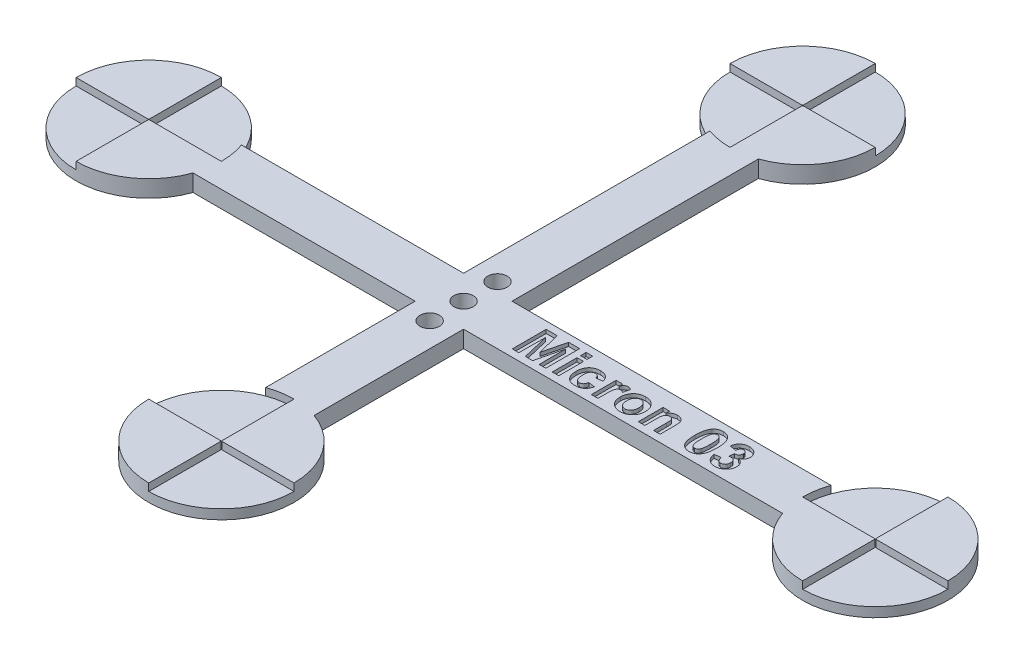
from build123d import *

# Parameters (mm, degrees)
BOSS_EXTRUDE1_DEPTH = 3.5
CUT_EXTRUDE1_START  = -1.52
CUT_EXTRUDE1_DEPTH  = 1.52
SKETCH3_R           = 2
CUT_EXTRUDE2_DEPTH  = 186.640108813
SKETCH5_W           = 1.346153846
SKETCH5_H           = 1.166666667
SKETCH5_H_2         = 5.115384615
CUT_EXTRUDE3_DEPTH  = 0.75


with BuildPart() as part:
    # Sketch1 → Boss-Extrude1 (new body)
    with BuildSketch(Plane(origin=(0, 0, 0), x_dir=(1, 0, 0), z_dir=(0, 1, 0))):
        with BuildLine():
            Line((60, 55.857864376), (60, 5))
            Line((60, 5), (14.142135624, 5))
            ThreePointArc((14.142135624, 5), (-15, 0), (14.142135624, -5))
            Line((14.142135624, -5), (60, -5))
            Line((60, -5), (60, -35.857864376))
            ThreePointArc((60, -35.857864376), (65, -65), (70, -35.857864376))
            Line((70, -35.857864376), (70, -5))
            Line((70, -5), (135.857864376, -5))
            ThreePointArc((135.857864376, -5), (165, 0), (135.857864376, 5))
            Line((135.857864376, 5), (70, 5))
            Line((70, 5), (70, 55.857864376))
            ThreePointArc((70, 55.857864376), (65, 85), (60, 55.857864376))
        make_face()
    extrude(amount=BOSS_EXTRUDE1_DEPTH)

    # Sketch2 → Cut-Extrude1 (cut)
    with BuildSketch(Plane(origin=(0, 3.5, 0), x_dir=(1, 0, 0), z_dir=(0, 1, 0)).offset(CUT_EXTRUDE1_START)):
        with BuildLine():
            Line((65, -65), (65, -50.1))
            ThreePointArc((65, -50.1), (64.929289322, -50.070710678), (64.9, -50))
            Line((64.9, -50), (50, -50))
            ThreePointArc((50, -50), (54.393398282, -39.393398282), (65, -35))
            Line((65, -35), (65, -49.9))
            ThreePointArc((65, -49.9), (65.070710678, -49.929289322), (65.1, -50))
            Line((65.1, -50), (80, -50))
            ThreePointArc((80, -50), (75.606601718, -60.606601718), (65, -65))
        make_face()
        with BuildLine():
            Line((-15, 0), (-0.1, 0))
            ThreePointArc((-0.1, 0), (-0.070710678, 0.070710678), (0, 0.1))
            Line((0, 0.1), (0, 15))
            ThreePointArc((0, 15), (10.606601718, 10.606601718), (15, 0))
            Line((15, 0), (0.1, 0))
            ThreePointArc((0.1, 0), (0.070710678, -0.070710678), (0, -0.1))
            Line((0, -0.1), (0, -15))
            ThreePointArc((0, -15), (-10.606601718, -10.606601718), (-15, 0))
        make_face()
        with BuildLine():
            Line((50, 70), (64.9, 70))
            ThreePointArc((64.9, 70), (64.929289322, 70.070710678), (65, 70.1))
            Line((65, 70.1), (65, 85))
            ThreePointArc((65, 85), (75.606601718, 80.606601718), (80, 70))
            Line((80, 70), (65.1, 70))
            ThreePointArc((65.1, 70), (65.070710678, 69.929289322), (65, 69.9))
            Line((65, 69.9), (65, 55))
            ThreePointArc((65, 55), (54.393398282, 59.393398282), (50, 70))
        make_face()
        with BuildLine():
            Line((150, 15), (150, 0.1))
            ThreePointArc((150, 0.1), (150.070710678, 0.070710678), (150.1, 0))
            Line((150.1, 0), (165, 0))
            ThreePointArc((165, 0), (160.606601718, -10.606601718), (150, -15))
            Line((150, -15), (150, -0.1))
            ThreePointArc((150, -0.1), (149.929289322, -0.070710678), (149.9, 0))
            Line((149.9, 0), (135, 0))
            ThreePointArc((135, 0), (139.393398282, 10.606601718), (150, 15))
        make_face()
    extrude(amount=CUT_EXTRUDE1_DEPTH, mode=Mode.SUBTRACT)

    # Sketch3 → Cut-Extrude2 (cut, through all)
    with BuildSketch(Plane(origin=(0, 3.5, 0), x_dir=(1, 0, 0), z_dir=(0, 1, 0))):
        with Locations(Location((65, 0, 0), (0, 0, 270))):
            Circle(SKETCH3_R)
        with Locations(Location((65, 7, 0), (0, 0, 270))):
            Circle(SKETCH3_R)
        with Locations(Location((65, -7, 0), (0, 0, 270))):
            Circle(SKETCH3_R)
    extrude(amount=-CUT_EXTRUDE2_DEPTH, mode=Mode.SUBTRACT)

    # Sketch5 → Cut-Extrude3 (cut)
    # profile 1 of 9: a face of its own
    with BuildSketch(Plane(origin=(0, 3.5, 0), x_dir=(1, 0, 0), z_dir=(0, 1, 0))):
        Polygon((78.557137316, -3.5), (78.557137316, 3.5), (80.834380906, 3.5), (82.012265521, -1.274639423), (83.190150137, 3.5), (85.467393727, 3.5), (85.467393727, -3.5), (84.12123988, -3.5), (84.076368086, 2.010817308), (82.762465842, -3.5), (81.262065201, -3.5), (79.948162957, 2.010817308), (79.903291162, -3.5), align=None)
    # profile 2 of 9: a face of its own
    with BuildSketch(Plane(origin=(0, 3.5, 0), x_dir=(1, 0, 0), z_dir=(0, 1, 0))):
        with Locations((87.486624496, 2.916666667)):
            Rectangle(SKETCH5_W, SKETCH5_H)
    # profile 3 of 9: a face of its own
    with BuildSketch(Plane(origin=(0, 3.5, 0), x_dir=(1, 0, 0), z_dir=(0, 1, 0))):
        with Locations((87.486624496, -0.942307692)):
            Rectangle(SKETCH5_W, SKETCH5_H_2)
    # profile 4 of 9: a face of its own
    with BuildSketch(Plane(origin=(0, 3.5, 0), x_dir=(1, 0, 0), z_dir=(0, 1, 0))):
        with BuildLine():
            Line((93.723803983, 0.08974359), (92.377650137, -0.08974359))
            add(Edge.make_bspline(
                [(92.377650137, -0.08974359), (92.365277654, -0.026702881), (92.341673882, 0.09356389), (92.281826173, 0.260113107), (92.199974577, 0.401670835), (92.097611893, 0.51732494), (91.97712351, 0.607450251), (91.840268759, 0.673171422), (91.685581657, 0.711401306), (91.577185865, 0.715710363), (91.520879304, 0.717948718)],
                knots=[0, 0, 0, 0, 1.183520367, 2.2578771, 3.246797608, 4.180863388, 5.085846032, 6.003342148, 6.962829327, 8, 8, 8, 8], degree=3))
            add(Edge.make_bspline(
                [(91.520879304, 0.717948718), (91.482498221, 0.716894897), (91.407684642, 0.714840756), (91.298251479, 0.698098117), (91.195737937, 0.667745464), (91.097523133, 0.629114343), (91.006836345, 0.576495155), (90.920991012, 0.514299213), (90.842675236, 0.439090326), (90.769257744, 0.353129964), (90.701753909, 0.253995306), (90.647051205, 0.137976859), (90.599085607, 0.00804074), (90.560102543, -0.137503523), (90.530047591, -0.298346655), (90.507427047, -0.474341951), (90.495339603, -0.665426066), (90.493822197, -0.797860734), (90.493034752, -0.866586538)],
                knots=[0, 0, 0, 0, 0.862078219, 1.680389174, 2.478024961, 3.259954283, 4.04533088, 4.826625376, 5.636266677, 6.477958853, 7.363321064, 8.321359119, 9.351280941, 10.472100686, 11.701575432, 13.024867311, 14.456081111, 16, 16, 16, 16], degree=3))
            add(Edge.make_bspline(
                [(90.493034752, -0.866586538), (90.493639899, -0.942801282), (90.494806774, -1.089762544), (90.509341595, -1.301712899), (90.531002417, -1.496036651), (90.561525189, -1.673267835), (90.601624875, -1.832782613), (90.650795425, -1.975411342), (90.707047794, -2.101633999), (90.776070584, -2.209065714), (90.850031931, -2.303056702), (90.933314865, -2.381466575), (91.019308158, -2.451942196), (91.114884123, -2.505825956), (91.214352737, -2.550853781), (91.321603773, -2.578852356), (91.433547011, -2.60039896), (91.510950539, -2.601834056), (91.550326419, -2.602564103)],
                knots=[0, 0, 0, 0, 1.594318435, 3.074248329, 4.44256617, 5.683784585, 6.834147545, 7.879495874, 8.83778105, 9.716843238, 10.544636748, 11.333080285, 12.105903466, 12.864046512, 13.621684801, 14.38335177, 15.177596319, 16, 16, 16, 16], degree=3))
            add(Edge.make_bspline(
                [(91.550326419, -2.602564103), (91.608100413, -2.600080116), (91.720157046, -2.595262252), (91.879276685, -2.552096012), (92.022202191, -2.482192159), (92.125844391, -2.400004579), (92.201111917, -2.320853296), (92.250138108, -2.247946339), (92.299458931, -2.168177702), (92.339930185, -2.075871785), (92.380235919, -1.975436952), (92.412480151, -1.86369039), (92.444507148, -1.743466381), (92.459601538, -1.65899259), (92.467393727, -1.615384615)],
                knots=[0, 0, 0, 0, 1.391704634, 2.699306801, 3.945045311, 5.206156062, 5.868460975, 6.572467336, 7.320954464, 8.128297893, 8.999513781, 9.930638866, 10.931732014, 12, 12, 12, 12], degree=3))
            Line((92.467393727, -1.615384615), (93.813547573, -1.794871795))
            add(Edge.make_bspline(
                [(93.813547573, -1.794871795), (93.795825896, -1.866656924), (93.76109447, -2.007343377), (93.693590707, -2.209373129), (93.61479608, -2.39820651), (93.525624874, -2.574376956), (93.422745577, -2.73598165), (93.309013151, -2.88413537), (93.183178776, -3.017960811), (93.046861568, -3.139555075), (92.897935718, -3.246410319), (92.736172899, -3.337665389), (92.563936639, -3.416820643), (92.378388792, -3.479144939), (92.181836268, -3.530502493), (91.972413371, -3.564327421), (91.751309208, -3.58604953), (91.599927011, -3.588491221), (91.522281547, -3.58974359)],
                knots=[0, 0, 0, 0, 1.110268429, 2.175934317, 3.195555169, 4.181481111, 5.137790904, 6.068820232, 6.982751273, 7.892872169, 8.808581235, 9.729898078, 10.678730826, 11.651191499, 12.666063818, 13.726769105, 14.834036833, 16, 16, 16, 16], degree=3))
            add(Edge.make_bspline(
                [(91.522281547, -3.58974359), (91.433837068, -3.587598112), (91.261478322, -3.583417051), (91.009756242, -3.550566524), (90.771780691, -3.496564037), (90.547501703, -3.418433664), (90.33596962, -3.32101378), (90.139359833, -3.198661043), (89.956602846, -3.055097693), (89.788125382, -2.890737636), (89.63650412, -2.707369312), (89.505615698, -2.505114604), (89.394554044, -2.286498364), (89.303031081, -2.051298732), (89.233226582, -1.7983952), (89.183681025, -1.529069784), (89.151714713, -1.243154327), (89.148519923, -1.047097203), (89.146880906, -0.946514423)],
                knots=[0, 0, 0, 0, 1.056003706, 2.057917874, 3.026125023, 3.965316587, 4.889355399, 5.801804771, 6.724223409, 7.659808022, 8.607570672, 9.559810849, 10.530974559, 11.531347954, 12.568834288, 13.659317828, 14.799164681, 16, 16, 16, 16], degree=3))
            add(Edge.make_bspline(
                [(89.146880906, -0.946514423), (89.148524185, -0.844997295), (89.151727972, -0.647076357), (89.18360297, -0.358828298), (89.233094763, -0.087580716), (89.30349607, 0.166297338), (89.392466257, 0.40326616), (89.504363423, 0.62183937), (89.635046938, 0.82419118), (89.786794153, 1.007446493), (89.954769379, 1.171954778), (90.138621428, 1.31436025), (90.335702579, 1.436043892), (90.547842096, 1.534147473), (90.773642785, 1.612120293), (91.013992037, 1.665925315), (91.268498667, 1.698802364), (91.442718724, 1.702983298), (91.532097252, 1.705128205)],
                knots=[0, 0, 0, 0, 1.206261992, 2.351765734, 3.442553085, 4.480484798, 5.479315179, 6.445885781, 7.393622348, 8.336902565, 9.26806234, 10.182699256, 11.09556262, 12.0152312, 12.955233282, 13.92969179, 14.937888647, 16, 16, 16, 16], degree=3))
            add(Edge.make_bspline(
                [(91.532097252, 1.705128205), (91.605070142, 1.704384231), (91.747559928, 1.702931518), (91.955377865, 1.681938632), (92.151931544, 1.652324627), (92.3370707, 1.608373074), (92.510877772, 1.55291005), (92.67305557, 1.48425635), (92.822943463, 1.401899226), (92.962440511, 1.308174096), (93.090726225, 1.200105), (93.210447231, 1.080931127), (93.320267383, 0.947732157), (93.421478043, 0.802315403), (93.510713897, 0.64234233), (93.592738582, 0.470830941), (93.663920966, 0.285320122), (93.703546565, 0.155903844), (93.723803983, 0.08974359)],
                knots=[0, 0, 0, 0, 1.178528697, 2.301242291, 3.371523624, 4.388184023, 5.372173667, 6.316227488, 7.228761945, 8.131556558, 9.02696084, 9.934795517, 10.857276148, 11.812560878, 12.793328268, 13.813516901, 14.882225015, 16, 16, 16, 16], degree=3))
        make_face()
    # profile 5 of 9: a face of its own
    with BuildSketch(Plane(origin=(0, 3.5, 0), x_dir=(1, 0, 0), z_dir=(0, 1, 0))):
        with BuildLine():
            Line((96.236624496, -3.5), (94.89047065, -3.5))
            Line((94.89047065, -3.5), (94.89047065, 1.615384615))
            Line((94.89047065, 1.615384615), (96.236624496, 1.615384615))
            Line((96.236624496, 1.615384615), (96.236624496, 0.901642628))
            add(Edge.make_bspline(
                [(96.236624496, 0.901642628), (96.259883743, 0.941904311), (96.304756328, 1.019578614), (96.371134323, 1.130348316), (96.437190473, 1.229067778), (96.502313101, 1.315738052), (96.562695006, 1.393610289), (96.624125097, 1.458290396), (96.681838486, 1.513862665), (96.759057766, 1.569417784), (96.85816177, 1.623638198), (96.982722375, 1.672376349), (97.116123027, 1.699014333), (97.206867798, 1.7030602), (97.253251098, 1.705128205)],
                knots=[0, 0, 0, 0, 1.218987753, 2.351715484, 3.384890168, 4.330893419, 5.1939795, 5.965577503, 6.66790098, 7.29043559, 8.453252551, 9.620708942, 10.783848683, 12, 12, 12, 12], degree=3))
            add(Edge.make_bspline(
                [(97.253251098, 1.705128205), (97.320405095, 1.701358096), (97.455282291, 1.693785921), (97.655090934, 1.639699112), (97.849368018, 1.548142305), (97.969512799, 1.464847397), (98.031496291, 1.421875)],
                knots=[0, 0, 0, 0, 0.956058025, 1.920219652, 2.927027487, 4, 4, 4, 4], degree=3))
            Line((98.031496291, 1.421875), (97.717393727, 0.141626603))
            add(Edge.make_bspline(
                [(97.717393727, 0.141626603), (97.664449803, 0.174925236), (97.563581431, 0.238365546), (97.406138295, 0.305762948), (97.25470486, 0.349888023), (97.154428404, 0.35601587), (97.106015521, 0.358974359)],
                knots=[0, 0, 0, 0, 1.139741959, 2.17142794, 3.117176162, 4, 4, 4, 4], degree=3))
            add(Edge.make_bspline(
                [(97.106015521, 0.358974359), (97.062383442, 0.357110478), (96.977443556, 0.353482004), (96.855168651, 0.324585509), (96.742438401, 0.278028965), (96.638804629, 0.211102954), (96.546124762, 0.117496866), (96.466335118, -0.005816935), (96.399557381, -0.159976511), (96.348517599, -0.309611834), (96.316692358, -0.455051639), (96.294248724, -0.593539742), (96.277196049, -0.759330249), (96.261585532, -0.951920701), (96.251121722, -1.171736755), (96.242884255, -1.418086441), (96.236934639, -1.691545137), (96.236731023, -1.882742337), (96.236624496, -1.982772436)],
                knots=[0, 0, 0, 0, 0.752818562, 1.4655346, 2.15662141, 2.850671748, 3.581264886, 4.414089304, 5.371394652, 6.476667933, 7.138571115, 7.940099809, 8.898357565, 10.015825393, 11.276710544, 12.698206094, 14.272575274, 16, 16, 16, 16], degree=3))
            Line((96.236624496, -1.982772436), (96.236624496, -3.5))
        make_face()
    # profile 6 of 9: a face of its own
    with BuildSketch(Plane(origin=(0, 3.5, 0), x_dir=(1, 0, 0), z_dir=(0, 1, 0))):
        with BuildLine():
            add(Edge.make_bspline(
                [(98.30072706, -0.870793269), (98.305045962, -0.760235903), (98.313692137, -0.538906871), (98.37545065, -0.210134176), (98.479986613, 0.112038713), (98.596998472, 0.373436964), (98.712536167, 0.573274145), (98.805840225, 0.717377785), (98.910004027, 0.850655554), (99.022895624, 0.973952054), (99.141975554, 1.090223099), (99.271436787, 1.195191373), (99.409604934, 1.290665645), (99.555130892, 1.377699163), (99.70780662, 1.45411696), (99.864797668, 1.522044624), (100.026738449, 1.577858255), (100.192500665, 1.624143401), (100.362803099, 1.66126573), (100.537692719, 1.68557028), (100.716957733, 1.701776453), (100.837816813, 1.704000672), (100.899084432, 1.705128205)],
                knots=[0, 0, 0, 0, 1.619840069, 3.242819969, 4.882696853, 6.574901176, 7.427927767, 8.263869039, 9.088735507, 9.903385011, 10.712399333, 11.525463381, 12.34252837, 13.171904741, 14.008210778, 14.842888174, 15.67691885, 16.516221154, 17.363978437, 18.229048737, 19.10224397, 20, 20, 20, 20], degree=3))
            add(Edge.make_bspline(
                [(100.899084432, 1.705128205), (100.992210311, 1.703136544), (101.175407967, 1.69921854), (101.443599, 1.663530133), (101.69856042, 1.604734262), (101.940636298, 1.522866388), (102.170009096, 1.417918164), (102.385525042, 1.287469155), (102.588964705, 1.13534666), (102.776477597, 0.960622814), (102.947873031, 0.769310702), (103.096522834, 0.562484273), (103.223397384, 0.344144411), (103.328477544, 0.113944009), (103.408239879, -0.129331778), (103.463344151, -0.385087436), (103.500243667, -0.652374343), (103.50396088, -0.835142162), (103.505855265, -0.928285256)],
                knots=[0, 0, 0, 0, 1.076054793, 2.116819909, 3.120736197, 4.09633837, 5.065772102, 6.030360709, 7.002891056, 7.996945094, 8.988102315, 9.967288529, 10.93568283, 11.902870597, 12.887008047, 13.888537105, 14.923945207, 16, 16, 16, 16], degree=3))
            add(Edge.make_bspline(
                [(103.505855265, -0.928285256), (103.503953336, -1.022358858), (103.500230128, -1.20651696), (103.463550334, -1.47628572), (103.406832368, -1.734301905), (103.325441844, -1.980042151), (103.220586913, -2.213224526), (103.094263796, -2.434645511), (102.943126034, -2.643140663), (102.770071096, -2.836536926), (102.580135887, -3.012216977), (102.378157233, -3.168393642), (102.161698021, -3.297146595), (101.934555313, -3.405413896), (101.694392155, -3.48757604), (101.442576838, -3.546181121), (101.179301383, -3.58440277), (100.999247208, -3.587940756), (100.907497893, -3.58974359)],
                knots=[0, 0, 0, 0, 1.084306555, 2.122634113, 3.133511532, 4.127271514, 5.10202058, 6.077484774, 7.061903265, 8.065960046, 9.065303363, 10.042062392, 11.004391854, 11.964060687, 12.939122686, 13.924942149, 14.942623041, 16, 16, 16, 16], degree=3))
            add(Edge.make_bspline(
                [(100.907497893, -3.58974359), (100.793197459, -3.585999314), (100.565409876, -3.578537406), (100.228332141, -3.517331391), (99.899580393, -3.418578363), (99.634721788, -3.30491006), (99.432398884, -3.194068459), (99.2889167, -3.100765628), (99.153600151, -3.000634417), (99.029615405, -2.888525117), (98.914822638, -2.767656905), (98.80770116, -2.639200059), (98.712065202, -2.500189519), (98.625243515, -2.353150853), (98.547337372, -2.197033104), (98.482391397, -2.031407384), (98.425965203, -1.858219085), (98.379426741, -1.677074935), (98.344918868, -1.487198195), (98.319828269, -1.289197267), (98.304105213, -1.082783839), (98.301867118, -0.942335777), (98.30072706, -0.870793269)],
                knots=[0, 0, 0, 0, 1.610846835, 3.210231987, 4.81374032, 6.443368681, 7.263437361, 8.06418174, 8.855100662, 9.634539345, 10.417731031, 11.204243685, 11.990424874, 12.794120493, 13.610605693, 14.447765341, 15.300248309, 16.177865431, 17.082777535, 18.019649293, 18.991233806, 20, 20, 20, 20], degree=3))
        make_face()
        with BuildLine():
            add(Edge.make_bspline(
                [(99.646880906, -0.942307692), (99.647878584, -1.007320767), (99.649820064, -1.133836228), (99.667123886, -1.317908247), (99.693943922, -1.490762442), (99.735361519, -1.650791958), (99.785307076, -1.800159307), (99.848707519, -1.936877885), (99.921153825, -2.063536994), (100.007373027, -2.1753987), (100.101343593, -2.274418694), (100.199833871, -2.36240354), (100.303809872, -2.437322036), (100.41391022, -2.49823268), (100.529998823, -2.544473448), (100.650705668, -2.578404662), (100.776898878, -2.59833825), (100.862556349, -2.601139991), (100.90609565, -2.602564103)],
                knots=[0, 0, 0, 0, 1.334287467, 2.596523749, 3.792235791, 4.920928783, 5.98599801, 7.020725633, 8.009778093, 8.975087571, 9.91178927, 10.809031968, 11.682407688, 12.537028737, 13.385161363, 14.241880569, 15.106355953, 16, 16, 16, 16], degree=3))
            add(Edge.make_bspline(
                [(100.90609565, -2.602564103), (100.949636837, -2.601144665), (101.035298021, -2.598352119), (101.161464162, -2.578351489), (101.281853749, -2.544786823), (101.397190506, -2.497854846), (101.507005984, -2.437377328), (101.61091724, -2.362353397), (101.709336483, -2.274781598), (101.802542893, -2.175227372), (101.886267606, -2.061842509), (101.959423839, -1.935578805), (102.022822325, -1.79833688), (102.072998654, -1.64817726), (102.112146338, -1.486306038), (102.139600285, -1.312329148), (102.15676443, -1.126346658), (102.158702325, -0.99843674), (102.159701419, -0.932491987)],
                knots=[0, 0, 0, 0, 0.891374549, 1.753654511, 2.608197993, 3.445305504, 4.297756158, 5.168913853, 6.063877914, 6.991658187, 7.956416983, 8.942957645, 9.975057474, 11.046479855, 12.179282068, 13.381405243, 14.649967197, 16, 16, 16, 16], degree=3))
            add(Edge.make_bspline(
                [(102.159701419, -0.932491987), (102.158697367, -0.867950124), (102.156751088, -0.742840612), (102.139683714, -0.561031756), (102.111771172, -0.390422553), (102.073298945, -0.231185172), (102.022561895, -0.083047614), (101.959026888, 0.052619974), (101.886748624, 0.178516236), (101.80205349, 0.290714614), (101.709395678, 0.390209804), (101.610902071, 0.477726842), (101.507009908, 0.552764833), (101.397189486, 0.61323871), (101.281854027, 0.660171642), (101.161464087, 0.693736048), (101.035298041, 0.713736749), (100.949636844, 0.716529285), (100.90609565, 0.717948718)],
                knots=[0, 0, 0, 0, 1.332105243, 2.582185114, 3.76554119, 4.898206757, 5.96011018, 6.991864232, 7.986448439, 8.951336849, 9.886681577, 10.788942532, 11.667203022, 12.526603947, 13.370536632, 14.232047448, 15.101357822, 16, 16, 16, 16], degree=3))
            add(Edge.make_bspline(
                [(100.90609565, 0.717948718), (100.862556349, 0.716524606), (100.776898878, 0.713722865), (100.650705668, 0.693789278), (100.529998823, 0.659858063), (100.41391022, 0.613617296), (100.303809872, 0.552706651), (100.199833871, 0.477788156), (100.101343593, 0.38980331), (100.007373027, 0.290783316), (99.921153825, 0.17892161), (99.848707519, 0.052262501), (99.785307076, -0.084456078), (99.735361519, -0.233823426), (99.693943922, -0.393852943), (99.667123886, -0.566707137), (99.649820064, -0.750779157), (99.647878584, -0.877294617), (99.646880906, -0.942307692)],
                knots=[0, 0, 0, 0, 0.893644047, 1.758119431, 2.614838637, 3.462971263, 4.317592312, 5.190968032, 6.08821073, 7.024912429, 7.990221907, 8.979274367, 10.01400199, 11.079071217, 12.207764209, 13.403476251, 14.665712533, 16, 16, 16, 16], degree=3))
        make_face(mode=Mode.SUBTRACT)
    # profile 7 of 9: a face of its own
    with BuildSketch(Plane(origin=(0, 3.5, 0), x_dir=(1, 0, 0), z_dir=(0, 1, 0))):
        with BuildLine():
            Line((109.069957829, -3.5), (107.723803983, -3.5))
            Line((107.723803983, -3.5), (107.723803983, -0.875))
            add(Edge.make_bspline(
                [(107.723803983, -0.875), (107.723602692, -0.80862339), (107.723218494, -0.681932094), (107.718527885, -0.50151225), (107.713477967, -0.33926398), (107.705359809, -0.195690673), (107.69420945, -0.069881136), (107.680940928, 0.037381776), (107.664227581, 0.126316058), (107.640514055, 0.219075396), (107.603280694, 0.31750614), (107.542853534, 0.419454306), (107.472803641, 0.509977418), (107.387946168, 0.584030176), (107.292843867, 0.643744945), (107.188425092, 0.687766967), (107.073926815, 0.713473714), (106.994769027, 0.71642676), (106.953972252, 0.717948718)],
                knots=[0, 0, 0, 0, 1.585090075, 3.025419896, 4.30986405, 5.461533023, 6.458985685, 7.325703005, 8.041573048, 8.618245387, 9.611190897, 10.541623111, 11.439410311, 12.333024322, 13.215695708, 14.111259627, 15.026570636, 16, 16, 16, 16], degree=3))
            add(Edge.make_bspline(
                [(106.953972252, 0.717948718), (106.901446439, 0.715341443), (106.798008909, 0.710207014), (106.646127096, 0.674643139), (106.504272122, 0.611656212), (106.371854194, 0.527573319), (106.255091054, 0.423166044), (106.155813236, 0.301229295), (106.077510643, 0.163292863), (106.028725935, 0.034500293), (105.9997776, -0.082074788), (105.980077313, -0.18736516), (105.965963353, -0.310222482), (105.951055688, -0.449397921), (105.942646526, -0.606201002), (105.933263474, -0.779079665), (105.929808832, -0.969405207), (105.929233196, -1.1016966), (105.928932188, -1.170873397)],
                knots=[0, 0, 0, 0, 1.032418065, 2.033110358, 3.045378521, 4.070039643, 5.104744895, 6.110696385, 7.147805894, 8.209255037, 8.806501049, 9.507534436, 10.313289552, 11.236712342, 12.258650821, 13.399345464, 14.640085731, 16, 16, 16, 16], degree=3))
            Line((105.928932188, -1.170873397), (105.928932188, -3.5))
            Line((105.928932188, -3.5), (104.582778342, -3.5))
            Line((104.582778342, -3.5), (104.582778342, 1.615384615))
            Line((104.582778342, 1.615384615), (105.928932188, 1.615384615))
            Line((105.928932188, 1.615384615), (105.928932188, 0.877804487))
            add(Edge.make_bspline(
                [(105.928932188, 0.877804487), (105.980976174, 0.94337945), (106.08236259, 1.07112544), (106.252101926, 1.240902011), (106.431871591, 1.384984638), (106.622482327, 1.502597736), (106.823836354, 1.593383288), (107.035011442, 1.657323362), (107.256181645, 1.698687167), (107.407176778, 1.702955825), (107.484020329, 1.705128205)],
                knots=[0, 0, 0, 0, 1.096260936, 2.135615983, 3.138008533, 4.108575778, 5.062498258, 6.023394349, 6.994077526, 8, 8, 8, 8], degree=3))
            add(Edge.make_bspline(
                [(107.484020329, 1.705128205), (107.551455459, 1.703432581), (107.684254807, 1.700093404), (107.87840855, 1.668042033), (108.063790206, 1.617716821), (108.237815142, 1.547521772), (108.39780225, 1.463814733), (108.538360931, 1.365944084), (108.659178646, 1.258012012), (108.758264399, 1.136836476), (108.838935335, 1.006444736), (108.909151731, 0.869613801), (108.963410859, 0.7231182), (109.005291646, 0.56393665), (109.033684021, 0.383505727), (109.056317805, 0.173923523), (109.067737625, -0.069988674), (109.069186888, -0.243982006), (109.069957829, -0.336538462)],
                knots=[0, 0, 0, 0, 1.087471829, 2.141547729, 3.166311014, 4.181815879, 5.163737, 6.073971965, 6.939083136, 7.769667735, 8.590016746, 9.409741311, 10.247555639, 11.105633939, 12.06171977, 13.192085209, 14.506318385, 16, 16, 16, 16], degree=3))
            Line((109.069957829, -0.336538462), (109.069957829, -3.5))
        make_face()
    # profile 8 of 9: a face of its own
    with BuildSketch(Plane(origin=(0, 3.5, 0), x_dir=(1, 0, 0), z_dir=(0, 1, 0))):
        with BuildLine():
            add(Edge.make_bspline(
                [(115.127650137, 3.5), (115.210973459, 3.497990296), (115.373194416, 3.494077632), (115.609568213, 3.459418509), (115.832125907, 3.403844539), (116.040851165, 3.325286793), (116.235548447, 3.223275021), (116.414920872, 3.097373283), (116.582887972, 2.951355615), (116.679882834, 2.838043484), (116.729012316, 2.780649038)],
                knots=[0, 0, 0, 0, 1.098584764, 2.138818609, 3.143716932, 4.11936356, 5.073598562, 6.034819447, 7.004603936, 8, 8, 8, 8], degree=3))
            add(Edge.make_bspline(
                [(116.729012316, 2.780649038), (116.757115165, 2.744096358), (116.814468155, 2.669498744), (116.89170974, 2.548957239), (116.965967015, 2.421089291), (117.030786368, 2.282817073), (117.092853708, 2.136540065), (117.150372484, 1.981924967), (117.200314244, 1.817694297), (117.24730652, 1.645948025), (117.285600914, 1.464003892), (117.320988477, 1.273826094), (117.350326359, 1.07455247), (117.373461009, 0.866820582), (117.394122544, 0.650946485), (117.405444064, 0.425900053), (117.414713976, 0.192183791), (117.415640415, 0.033196977), (117.416111675, -0.047676282)],
                knots=[0, 0, 0, 0, 0.746761706, 1.524009783, 2.317797294, 3.140957436, 3.996208027, 4.892396322, 5.812273159, 6.776774596, 7.776522781, 8.823794876, 9.910947555, 11.039215469, 12.21036455, 13.424061321, 14.689674014, 16, 16, 16, 16], degree=3))
            add(Edge.make_bspline(
                [(117.416111675, -0.047676282), (117.415647514, -0.128549727), (117.414737711, -0.287069766), (117.405409505, -0.520317147), (117.394112451, -0.744894367), (117.37350921, -0.960779993), (117.350153056, -1.168470585), (117.32165396, -1.36752083), (117.283603433, -1.556824756), (117.245911455, -1.7384787), (117.199194678, -1.910956219), (117.147008626, -2.074892373), (117.09180168, -2.231434895), (117.028291268, -2.377900211), (116.961146178, -2.516343538), (116.887993989, -2.64551665), (116.809889936, -2.766805201), (116.751982092, -2.841796361), (116.723403342, -2.87880609)],
                knots=[0, 0, 0, 0, 1.308387162, 2.564569672, 3.776470597, 4.945886788, 6.07248526, 7.158029334, 8.197718558, 9.195987466, 10.159061779, 11.087054987, 11.979325145, 12.84323098, 13.668471539, 14.467659354, 15.243757377, 16, 16, 16, 16], degree=3))
            add(Edge.make_bspline(
                [(116.723403342, -2.87880609), (116.674723363, -2.935708583), (116.578626735, -3.048036851), (116.412518637, -3.192843578), (116.233443571, -3.316141502), (116.039089218, -3.416126038), (115.831383863, -3.495225841), (115.60846196, -3.549026443), (115.372733911, -3.583756125), (115.210509985, -3.587719301), (115.127650137, -3.58974359)],
                knots=[0, 0, 0, 0, 0.991631672, 1.957528776, 2.911425699, 3.867574088, 4.848108326, 5.850523106, 6.902101959, 8, 8, 8, 8], degree=3))
            add(Edge.make_bspline(
                [(115.127650137, -3.58974359), (115.043843229, -3.587332075), (114.87961925, -3.582606588), (114.639845122, -3.545146301), (114.411928808, -3.485135154), (114.196688524, -3.399455235), (113.99443224, -3.288420347), (113.80357985, -3.155320137), (113.628283527, -2.994127791), (113.491045634, -2.844066609), (113.390641979, -2.708475295), (113.319827907, -2.596038127), (113.251393654, -2.475725869), (113.192326668, -2.343776957), (113.134051837, -2.204094043), (113.08243865, -2.05366677), (113.036902449, -1.893788664), (112.994146853, -1.725189777), (112.958494985, -1.546708789), (112.925700499, -1.358872406), (112.899856676, -1.160881808), (112.876943465, -0.953839776), (112.860811252, -0.737257565), (112.847709837, -0.5114896), (112.841140381, -0.275813207), (112.839847904, -0.115454427), (112.839188598, -0.033653846)],
                knots=[0, 0, 0, 0, 1.257818097, 2.464759732, 3.634271214, 4.790227596, 5.933394726, 7.09190477, 8.274482889, 9.50191983, 10.139172818, 10.805000628, 11.49619854, 12.215266328, 12.973768034, 13.768328009, 14.601232062, 15.469317089, 16.379095881, 17.333267023, 18.331755967, 19.376479622, 20.460535752, 21.592206075, 22.771760786, 24, 24, 24, 24], degree=3))
            add(Edge.make_bspline(
                [(112.839188598, -0.033653846), (112.839649053, 0.046752502), (112.840551486, 0.204338611), (112.849947717, 0.43664665), (112.861095479, 0.6603017), (112.881922973, 0.875695222), (112.904951542, 1.082498955), (112.93397868, 1.280985552), (112.971083155, 1.47012808), (113.011481896, 1.65068144), (113.055796554, 1.823285057), (113.10846774, 1.986496157), (113.163122902, 2.142783223), (113.227375619, 2.288467292), (113.294108477, 2.426619238), (113.367317908, 2.555768146), (113.445407553, 2.677062789), (113.503317262, 2.75205316), (113.531896932, 2.7890625)],
                knots=[0, 0, 0, 0, 1.304469132, 2.556591843, 3.77188756, 4.93702727, 6.066781583, 7.147865049, 8.190466662, 9.19316792, 10.149665317, 11.080258032, 11.975027628, 12.834388201, 13.661940433, 14.463366943, 15.241638981, 16, 16, 16, 16], degree=3))
            add(Edge.make_bspline(
                [(113.531896932, 2.7890625), (113.580574234, 2.845970467), (113.676665577, 2.958309541), (113.842812364, 3.103037161), (114.022085413, 3.226867293), (114.217008558, 3.32565506), (114.424237765, 3.405839286), (114.646867933, 3.45921057), (114.882558423, 3.494031913), (115.044787604, 3.497982262), (115.127650137, 3.5)],
                knots=[0, 0, 0, 0, 0.991667276, 1.957599061, 2.911530233, 3.873218945, 4.847995157, 5.850445929, 6.902062539, 8, 8, 8, 8], degree=3))
        make_face()
        with BuildLine():
            add(Edge.make_bspline(
                [(115.127650137, 2.333333333), (115.08496527, 2.331377346), (115.000530703, 2.327508224), (114.877806939, 2.298834269), (114.761904466, 2.251515994), (114.65226456, 2.185460295), (114.551309982, 2.09356773), (114.46579241, 1.970359526), (114.391937624, 1.819162626), (114.35497736, 1.706149177), (114.335382509, 1.646233974)],
                knots=[0, 0, 0, 0, 0.899391665, 1.779078861, 2.640979247, 3.529945348, 4.464599804, 5.495588918, 6.672261578, 8, 8, 8, 8], degree=3))
            add(Edge.make_bspline(
                [(114.335382509, 1.646233974), (114.323145186, 1.601026296), (114.296843942, 1.503863032), (114.266993122, 1.34544653), (114.242375766, 1.165660571), (114.221588896, 0.964546936), (114.204672766, 0.741999201), (114.19425523, 0.497875761), (114.187054818, 0.232347672), (114.185928426, 0.048149154), (114.185342445, -0.047676282)],
                knots=[0, 0, 0, 0, 0.658986521, 1.416336438, 2.266694271, 3.212608458, 4.261595115, 5.407496572, 6.651304179, 8, 8, 8, 8], degree=3))
            add(Edge.make_bspline(
                [(114.185342445, -0.047676282), (114.186141326, -0.14302767), (114.187672646, -0.32580029), (114.19202109, -0.588135115), (114.204364221, -0.826933735), (114.216718503, -1.043147789), (114.237295105, -1.23609601), (114.257990887, -1.406299418), (114.286516619, -1.552595599), (114.325438332, -1.711718991), (114.384302432, -1.878266865), (114.465062219, -2.04628923), (114.551664335, -2.181203321), (114.6536661, -2.277800907), (114.764061896, -2.342600939), (114.878564469, -2.390212927), (115.001176477, -2.416929723), (115.084994509, -2.421003664), (115.127650137, -2.423076923)],
                knots=[0, 0, 0, 0, 1.613353868, 3.092528792, 4.438413522, 5.658843895, 6.755779493, 7.721003256, 8.558527904, 9.275869043, 10.491421475, 11.538327284, 12.426656321, 13.187490948, 13.890032692, 14.581719216, 15.278226227, 16, 16, 16, 16], degree=3))
            add(Edge.make_bspline(
                [(115.127650137, -2.423076923), (115.1708259, -2.421220141), (115.255319219, -2.417586488), (115.378203772, -2.38795648), (115.494271269, -2.342061023), (115.60317755, -2.274658528), (115.704037572, -2.183395172), (115.789492715, -2.06007625), (115.863367243, -1.908914362), (115.900324505, -1.795895589), (115.919917765, -1.735977564)],
                knots=[0, 0, 0, 0, 0.909107913, 1.77908945, 2.650019014, 3.530482969, 4.465025013, 5.495890128, 6.672421267, 8, 8, 8, 8], degree=3))
            add(Edge.make_bspline(
                [(115.919917765, -1.735977564), (115.932137385, -1.690766299), (115.958280861, -1.594038281), (115.988344392, -1.436607964), (116.013028395, -1.257753647), (116.033617624, -1.05755488), (116.050700146, -0.835487867), (116.061029249, -0.591824852), (116.068236435, -0.326765589), (116.06936967, -0.143034371), (116.069957829, -0.047676282)],
                knots=[0, 0, 0, 0, 0.66114423, 1.414496391, 2.261103113, 3.210114492, 4.255954433, 5.405607896, 6.653488082, 8, 8, 8, 8], degree=3))
            add(Edge.make_bspline(
                [(116.069957829, -0.047676282), (116.070022861, 0.04768509), (116.070147527, 0.230491244), (116.061887947, 0.493159052), (116.05378189, 0.732661087), (116.037252258, 0.948528178), (116.020696375, 1.141489365), (115.996032219, 1.310578558), (115.971185025, 1.457659427), (115.92872111, 1.616451226), (115.871012304, 1.783477729), (115.79217116, 1.953246036), (115.703049418, 2.086895444), (115.601786966, 2.185134457), (115.491934543, 2.251358804), (115.377150964, 2.29911527), (115.254748437, 2.32746093), (115.170327908, 2.331361465), (115.127650137, 2.333333333)],
                knots=[0, 0, 0, 0, 1.611146624, 3.088541111, 4.440175916, 5.659517762, 6.746360572, 7.711365618, 8.546319149, 9.264661039, 10.486047304, 11.528122518, 12.419721574, 13.184982167, 13.89070983, 14.574167459, 15.279187713, 16, 16, 16, 16], degree=3))
        make_face(mode=Mode.SUBTRACT)
    # profile 9 of 9: a face of its own
    with BuildSketch(Plane(origin=(0, 3.5, 0), x_dir=(1, 0, 0), z_dir=(0, 1, 0))):
        with BuildLine():
            Line((118.223803983, -1.51161859), (119.569957829, -1.346153846))
            add(Edge.make_bspline(
                [(119.569957829, -1.346153846), (119.581583265, -1.42892599), (119.603649979, -1.58603918), (119.672454874, -1.803503772), (119.762276225, -1.992744789), (119.881195188, -2.147799941), (120.018685525, -2.271118397), (120.172019038, -2.359110602), (120.339808749, -2.414600162), (120.45667698, -2.420207795), (120.516472252, -2.423076923)],
                knots=[0, 0, 0, 0, 1.26631894, 2.403651751, 3.447242243, 4.428907923, 5.348362865, 6.231623936, 7.095215805, 8, 8, 8, 8], degree=3))
            add(Edge.make_bspline(
                [(120.516472252, -2.423076923), (120.548775165, -2.422383235), (120.612762187, -2.421009148), (120.706824746, -2.406592273), (120.797204108, -2.382894363), (120.883008548, -2.348794837), (120.964647681, -2.306425711), (121.04319656, -2.255969846), (121.115355499, -2.192952569), (121.185805931, -2.124004992), (121.248324444, -2.04551958), (121.303395808, -1.9603662), (121.351737531, -1.869389447), (121.389207321, -1.770243601), (121.418537759, -1.665076293), (121.439506216, -1.553431013), (121.452267601, -1.435728603), (121.453794146, -1.355067428), (121.454573214, -1.313902244)],
                knots=[0, 0, 0, 0, 0.951760839, 1.885289532, 2.797832748, 3.70117291, 4.60103766, 5.506897018, 6.445598779, 7.420035506, 8.410036365, 9.396193293, 10.407074535, 11.440988179, 12.514285005, 13.622404236, 14.786601276, 16, 16, 16, 16], degree=3))
            add(Edge.make_bspline(
                [(121.454573214, -1.313902244), (121.451655056, -1.237502116), (121.446088351, -1.091760541), (121.403072653, -0.884992707), (121.328475746, -0.70323539), (121.223961824, -0.549749229), (121.099769545, -0.426281136), (120.9606486, -0.333472614), (120.805284121, -0.280154816), (120.697277295, -0.272898977), (120.642674175, -0.269230769)],
                knots=[0, 0, 0, 0, 1.241512862, 2.368321189, 3.414110003, 4.41529485, 5.36642979, 6.245396713, 7.112955941, 8, 8, 8, 8], degree=3))
            add(Edge.make_bspline(
                [(120.642674175, -0.269230769), (120.603800148, -0.270225485), (120.521391312, -0.272334178), (120.39320883, -0.29424374), (120.253425278, -0.324479925), (120.158243303, -0.353565129), (120.108419368, -0.368790064)],
                knots=[0, 0, 0, 0, 0.854525515, 1.811503923, 2.854410343, 4, 4, 4, 4], degree=3))
            Line((120.108419368, -0.368790064), (120.234621291, 0.717948718))
            add(Edge.make_bspline(
                [(120.234621291, 0.717948718), (120.27203001, 0.717307003), (120.344621451, 0.716061759), (120.450626731, 0.724850571), (120.549850941, 0.74089698), (120.64206256, 0.766932189), (120.727347446, 0.798518215), (120.806451486, 0.838203703), (120.877439444, 0.887590244), (120.963871884, 0.962138968), (121.052300085, 1.073845766), (121.132244774, 1.227020879), (121.176788352, 1.401672893), (121.182424142, 1.523997888), (121.185342445, 1.587339744)],
                knots=[0, 0, 0, 0, 0.916749589, 1.778948191, 2.604102396, 3.376994206, 4.124053722, 4.831292757, 5.54010828, 6.238660037, 7.62386988, 9.002523041, 10.447858069, 12, 12, 12, 12], degree=3))
            add(Edge.make_bspline(
                [(121.185342445, 1.587339744), (121.183374924, 1.641277155), (121.179602345, 1.744698242), (121.145759762, 1.891861662), (121.087997506, 2.021788751), (121.007201303, 2.132224223), (120.908091467, 2.221901207), (120.792247636, 2.288165965), (120.659559948, 2.326807146), (120.566275218, 2.331103943), (120.517874496, 2.333333333)],
                knots=[0, 0, 0, 0, 1.146968804, 2.199229744, 3.192297141, 4.153502289, 5.090509175, 6.0173182, 6.971286811, 8, 8, 8, 8], degree=3))
            add(Edge.make_bspline(
                [(120.517874496, 2.333333333), (120.46935181, 2.33093471), (120.373973024, 2.326219849), (120.237492901, 2.279582391), (120.11158267, 2.20742307), (120.000475937, 2.104084212), (119.904177323, 1.975557202), (119.82955285, 1.818808698), (119.776998729, 1.636294474), (119.758936868, 1.504931329), (119.749445009, 1.435897436)],
                knots=[0, 0, 0, 0, 0.889956214, 1.749345552, 2.62404616, 3.543272128, 4.520224035, 5.562553653, 6.719074424, 8, 8, 8, 8], degree=3))
            Line((119.749445009, 1.435897436), (118.403291162, 1.637820513))
            add(Edge.make_bspline(
                [(118.403291162, 1.637820513), (118.425487775, 1.740596413), (118.467977063, 1.93733251), (118.554789123, 2.212974605), (118.65665015, 2.456302971), (118.775659696, 2.670044425), (118.916629004, 2.857962328), (119.084002715, 3.021074883), (119.275276635, 3.164115229), (119.490085531, 3.283970496), (119.723645011, 3.380035281), (119.972208786, 3.451135323), (120.23514291, 3.491882025), (120.414904081, 3.497256697), (120.506656547, 3.5)],
                knots=[0, 0, 0, 0, 1.220808349, 2.336900656, 3.3513467, 4.279992853, 5.171472476, 6.069835959, 6.985198729, 7.938095762, 8.919113729, 9.91246339, 10.934493858, 12, 12, 12, 12], degree=3))
            add(Edge.make_bspline(
                [(120.506656547, 3.5), (120.585279093, 3.498210939), (120.738893394, 3.494715434), (120.962899453, 3.464637318), (121.174847314, 3.415775084), (121.375032436, 3.346656064), (121.564382811, 3.25865158), (121.739737405, 3.147927213), (121.904774857, 3.020121613), (122.002528442, 2.920657565), (122.051928983, 2.870392628)],
                knots=[0, 0, 0, 0, 1.096978699, 2.143298912, 3.148181587, 4.128190255, 5.094201205, 6.055441919, 7.017302331, 8, 8, 8, 8], degree=3))
            add(Edge.make_bspline(
                [(122.051928983, 2.870392628), (122.090087771, 2.827559407), (122.165455337, 2.742959353), (122.263309971, 2.607323269), (122.345209033, 2.466385138), (122.414680617, 2.32308569), (122.466343988, 2.174101965), (122.504859444, 2.021772631), (122.527736264, 1.864747954), (122.530239378, 1.758486372), (122.531496291, 1.705128205)],
                knots=[0, 0, 0, 0, 1.065582675, 2.104636323, 3.101288825, 4.092056841, 5.059084899, 6.026073946, 7.008813224, 8, 8, 8, 8], degree=3))
            add(Edge.make_bspline(
                [(122.531496291, 1.705128205), (122.52875453, 1.630076355), (122.523350016, 1.482135355), (122.473757011, 1.266925121), (122.394047579, 1.063483846), (122.283832255, 0.871034382), (122.140137074, 0.691362588), (121.963243046, 0.526085124), (121.758348067, 0.368894923), (121.604347748, 0.280104702), (121.524685393, 0.234174679)],
                knots=[0, 0, 0, 0, 0.957571776, 1.887550067, 2.804499428, 3.740591036, 4.709432777, 5.731457079, 6.826512349, 8, 8, 8, 8], degree=3))
            add(Edge.make_bspline(
                [(121.524685393, 0.234174679), (121.572088544, 0.222749449), (121.665631593, 0.200203459), (121.800765794, 0.154239331), (121.927319565, 0.095279758), (122.048392437, 0.030497087), (122.160979851, -0.046321993), (122.26726415, -0.131442581), (122.363180598, -0.229780823), (122.455090038, -0.33367547), (122.535430632, -0.447695629), (122.608023547, -0.566345819), (122.666331648, -0.692520971), (122.716202661, -0.822976901), (122.753362664, -0.959822212), (122.782461499, -1.102033084), (122.797046798, -1.250494678), (122.799490846, -1.351270534), (122.80072706, -1.40224359)],
                knots=[0, 0, 0, 0, 1.037381978, 2.047118658, 3.030848314, 4.005687143, 4.965748246, 5.927353932, 6.897971669, 7.885165084, 8.876109723, 9.862099733, 10.840989857, 11.829385213, 12.830906716, 13.855042526, 14.915067134, 16, 16, 16, 16], degree=3))
            add(Edge.make_bspline(
                [(122.80072706, -1.40224359), (122.799156199, -1.476692398), (122.796058251, -1.623515458), (122.762031078, -1.838999063), (122.710333383, -2.046092964), (122.639089374, -2.245633809), (122.54381002, -2.435180205), (122.429876278, -2.617391319), (122.294184827, -2.79045213), (122.139453017, -2.953051152), (121.970381315, -3.101875152), (121.788714326, -3.232596744), (121.597143608, -3.343236093), (121.394571508, -3.433704362), (121.182759522, -3.504094833), (120.959884253, -3.552473759), (120.727753584, -3.584749969), (120.568934053, -3.588063791), (120.48842738, -3.58974359)],
                knots=[0, 0, 0, 0, 1.006520189, 1.984993146, 2.943645202, 3.891894145, 4.845023195, 5.808336607, 6.795092628, 7.815033679, 8.841288157, 9.838185905, 10.83832808, 11.829129029, 12.835072876, 13.85234392, 14.911338897, 16, 16, 16, 16], degree=3))
            add(Edge.make_bspline(
                [(120.48842738, -3.58974359), (120.412135724, -3.588464554), (120.262280945, -3.585952227), (120.042906035, -3.556189634), (119.832793849, -3.512405359), (119.633170779, -3.448353676), (119.44229795, -3.369459951), (119.263778014, -3.267758105), (119.093015602, -3.152165524), (118.935589682, -3.016758045), (118.789217628, -2.869177748), (118.660647308, -2.706880639), (118.546074015, -2.535046684), (118.447530018, -2.352152449), (118.365841119, -2.157722674), (118.30223501, -1.952259222), (118.251507913, -1.736391279), (118.233165881, -1.587575284), (118.223803983, -1.51161859)],
                knots=[0, 0, 0, 0, 1.077528213, 2.11651914, 3.123276654, 4.10732375, 5.075386463, 6.036572488, 7.005896639, 7.98540975, 8.966414275, 9.939311093, 10.906719916, 11.882103104, 12.870994428, 13.882228509, 14.919075059, 16, 16, 16, 16], degree=3))
        make_face()
    extrude(amount=-CUT_EXTRUDE3_DEPTH, mode=Mode.SUBTRACT)


solid = part.part
